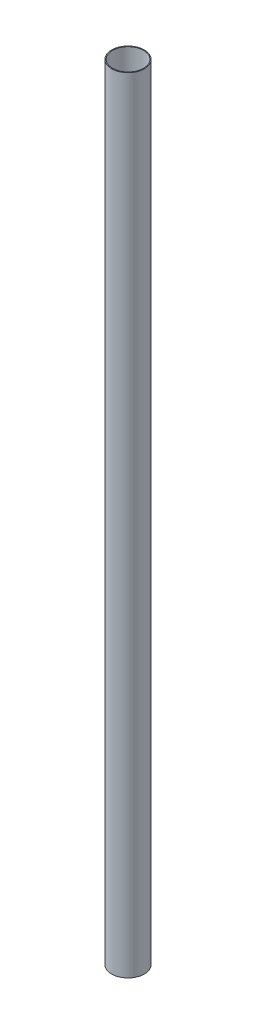
from build123d import *

# Parameters (mm, degrees)
SKETCH1_R           = 50.8
SKETCH1_R_2         = 48.26
BOSS_EXTRUDE1_DEPTH = 2438.4


with BuildPart() as part:
    # Sketch1 → Boss-Extrude1 (new body)
    with BuildSketch(Plane(origin=(0, 0, 0), x_dir=(1, 0, 0), z_dir=(0, 1, 0))):
        Circle(SKETCH1_R)
        Circle(SKETCH1_R_2, mode=Mode.SUBTRACT)
    extrude(amount=BOSS_EXTRUDE1_DEPTH)


solid = part.part
